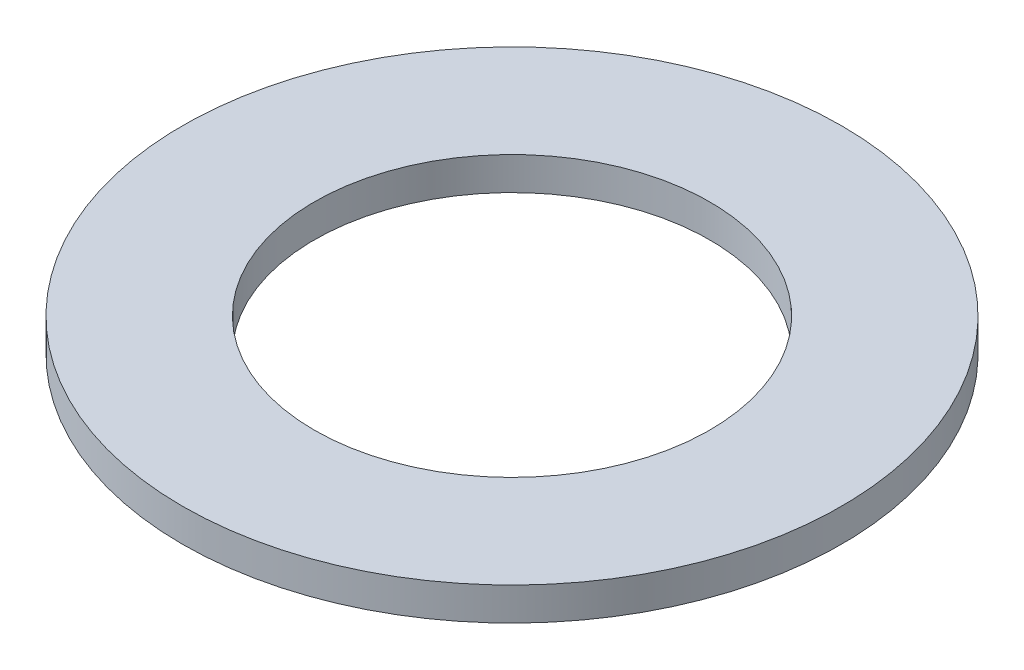
from build123d import *

# Parameters (mm, degrees)
SKETCH1_R           = 31.75
SKETCH1_R_2         = 19.05
BOSS_EXTRUDE1_DEPTH = 3.175


with BuildPart() as part:
    # Sketch1 → Boss-Extrude1 (new body)
    with BuildSketch(Plane(origin=(0, 0, 0), x_dir=(1, 0, 0), z_dir=(0, 1, 0))):
        with Locations(Location((0, 0, 0), (0, 0, 270))):
            Circle(SKETCH1_R)
        with Locations(Location((0, 0, 0), (0, 0, 270))):
            Circle(SKETCH1_R_2, mode=Mode.SUBTRACT)
    extrude(amount=BOSS_EXTRUDE1_DEPTH)


solid = part.part
